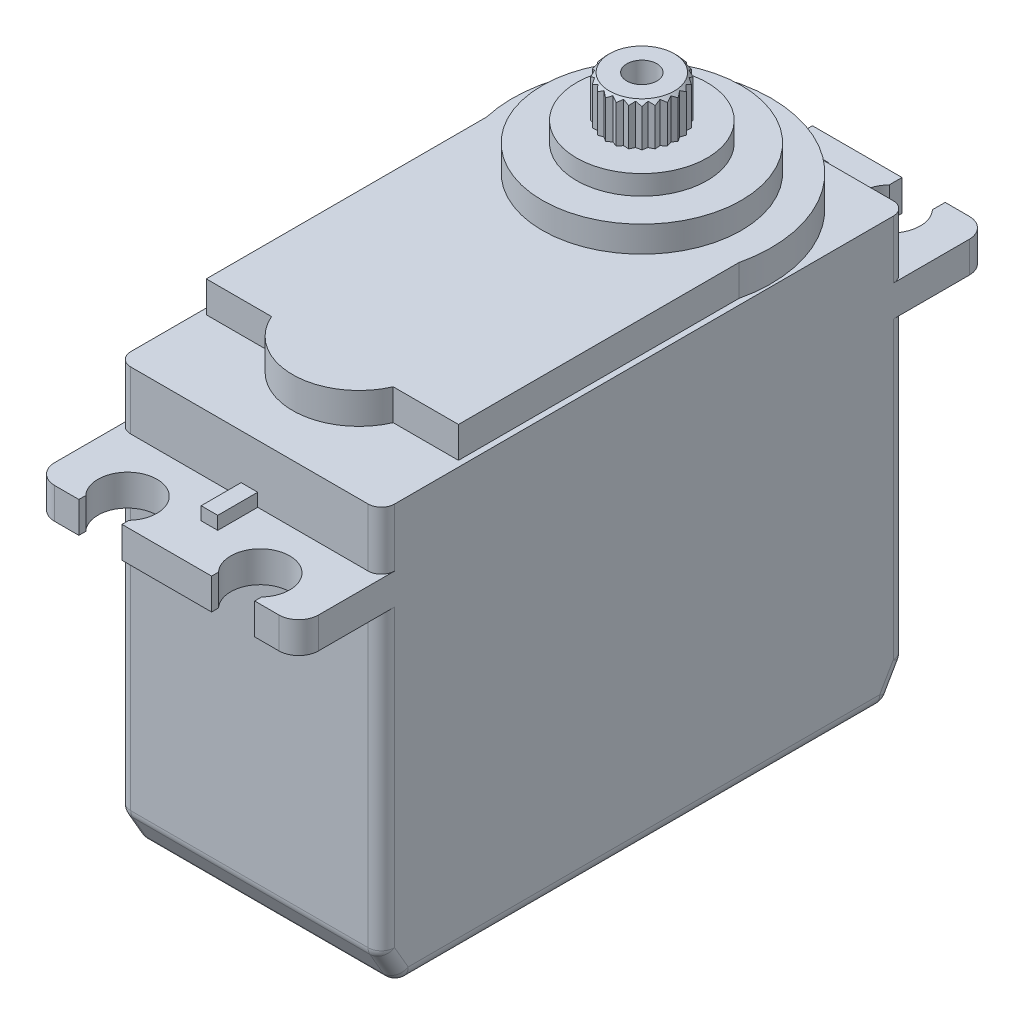
from build123d import *
from OCP.BRepFilletAPI import BRepFilletAPI_MakeChamfer

# Parameters (mm, degrees)
SKETCH1_W          = 20.2
SKETCH1_H          = 40.2
EXTRUDE1_DEPTH     = 25.4
SKETCH2_W          = 20.2
SKETCH2_H          = 40.2
EXTRUDE2_DEPTH     = 2.38125
SKETCH3_W          = 20.2
SKETCH3_H          = 40.2
EXTRUDE3_DEPTH     = 4.445
EXTRUDE4_DEPTH     = 2.38125
SKETCH5_R          = 7.62
EXTRUDE5_DEPTH     = 3.4925
SKETCH7_W          = 3.5
SKETCH7_H          = 1
EXTRUDE6_DEPTH     = 0.635
SKETCH8_R          = 2.778125
EXTRUDE7_DEPTH     = 3.175
CHAMFER2_SIZE      = 2.54
CHAMFER2_SIZE2     = 1.466469684
FILLET1_R          = 1.016
FILLET2_R          = 1.524
SKETCH9_W          = 6.35
SKETCH9_H          = 2.54
EXTRUDE8_DEPTH     = 2.38125
SKETCH10_W         = 5.08
SKETCH10_H         = 1.27
CUT_EXTRUDE1_DEPTH = 2.38125
CHAMFER3_SIZE      = 0.3
SKETCH11_R         = 3.778125
CUT_EXTRUDE2_DEPTH = 3.175
SKETCH12_R         = 1.15
CUT_EXTRUDE3_DEPTH = 3
CUT_EXTRUDE4_START = -1.5
SKETCH13_R         = 7.62
SKETCH13_R_2       = 5
CUT_EXTRUDE4_DEPTH = 1.5


with BuildPart() as part:
    # Sketch1 → Extrude1 (new body)
    with BuildSketch(Plane(origin=(0, 0, 0), x_dir=(1, 0, 0), z_dir=(0, 1, 0))):
        with Locations((0, -9.94)):
            Rectangle(SKETCH1_W, SKETCH1_H)
    extrude(amount=EXTRUDE1_DEPTH)

    # Sketch2 → Extrude2 (add)
    with BuildSketch(Plane(origin=(0, 25.4, 0), x_dir=(-1, 0, 0), z_dir=(0, 1, 0))):
        with Locations((0, 9.94)):
            Rectangle(SKETCH2_W, SKETCH2_H)
        with BuildLine():
            ThreePointArc((6.731, -15.51418631), (5.08, -11.7094), (3.429, -15.51418631))
            Line((3.429, -15.51418631), (3.429, -16.4846))
            Line((3.429, -16.4846), (-3.429, -16.4846))
            Line((-3.429, -16.4846), (-3.429, -15.51418631))
            ThreePointArc((-3.429, -15.51418631), (-5.08, -11.7094), (-6.731, -15.51418631))
            Line((-6.731, -15.51418631), (-6.731, -16.4846))
            Line((-6.731, -16.4846), (-10.1, -16.4846))
            Line((-10.1, -16.4846), (-10.1, -10.16))
            Line((-10.1, -10.16), (10.1, -10.16))
            Line((10.1, -10.16), (10.1, -16.4846))
            Line((10.1, -16.4846), (6.731, -16.4846))
            Line((6.731, -16.4846), (6.731, -15.51418631))
        make_face()
        with BuildLine():
            ThreePointArc((-6.731, 35.83418631), (-5.08, 32.0294), (-3.429, 35.83418631))
            Line((-3.429, 35.83418631), (-3.429, 36.3646))
            Line((-3.429, 36.3646), (3.429, 36.3646))
            Line((3.429, 36.3646), (3.429, 35.83418631))
            ThreePointArc((3.429, 35.83418631), (5.08, 32.0294), (6.731, 35.83418631))
            Line((6.731, 35.83418631), (6.731, 36.3646))
            Line((6.731, 36.3646), (10.1, 36.3646))
            Line((10.1, 36.3646), (10.1, 30.04))
            Line((10.1, 30.04), (-10.1, 30.04))
            Line((-10.1, 30.04), (-10.1, 36.3646))
            Line((-10.1, 36.3646), (-6.731, 36.3646))
            Line((-6.731, 36.3646), (-6.731, 35.83418631))
        make_face()
    extrude(amount=EXTRUDE2_DEPTH)

    # Sketch3 → Extrude3 (add)
    with BuildSketch(Plane(origin=(0, 27.78125, 0), x_dir=(-1, 0, 0), z_dir=(0, 1, 0))):
        with Locations((0, 9.94)):
            Rectangle(SKETCH3_W, SKETCH3_H)
    extrude(amount=EXTRUDE3_DEPTH)

    # Sketch4 → Extrude4 (add)
    with BuildSketch(Plane(origin=(0, 32.22625, 0), x_dir=(-1, 0, 0), z_dir=(0, 1, 0))):
        with BuildLine():
            Line((9.652, 2.228840954), (9.652, 23.69))
            Line((9.652, 23.69), (4.655896906, 23.69))
            ThreePointArc((4.655896906, 23.69), (0, 26.738), (-4.655896906, 23.69))
            Line((-4.655896906, 23.69), (-9.652, 23.69))
            Line((-9.652, 23.69), (-9.652, 2.228840954))
            ThreePointArc((-9.652, 2.228840954), (0, -9.906), (9.652, 2.228840954))
        make_face()
    extrude(amount=EXTRUDE4_DEPTH)

    # Sketch5 → Extrude5 (add)
    with BuildSketch(Plane(origin=(0, 34.6075, 0), x_dir=(-1, 0, 0), z_dir=(0, 1, 0))):
        with Locations(Location((0, 0, 0), (0, 0, 270))):
            Circle(SKETCH5_R)
    extrude(amount=EXTRUDE5_DEPTH)

    # Sketch7 → Extrude6 (add, symmetric)
    with BuildSketch(Plane(origin=(0, 0, 0), x_dir=(0, 0, -1), z_dir=(1, 0, 0))):
        with Locations((11.91, 28.28125)):
            Rectangle(SKETCH7_W, SKETCH7_H)
    extrude6 = extrude(amount=EXTRUDE6_DEPTH, both=True)

    # Mirror1: Extrude6 across plane
    add(extrude6.mirror(Plane.XY.offset(9.72)))

    # Sketch8 → Extrude7 (add)
    with BuildSketch(Plane(origin=(0, 38.1, 0), x_dir=(-1, 0, 0), z_dir=(0, 1, 0))):
        with Locations(Location((0, 0, 0), (0, 0, 270))):
            Circle(SKETCH8_R)
    extrude(amount=EXTRUDE7_DEPTH)

    # Chamfer2: one chamfer whose edges measure the first distance from different faces: ONE call of the kernel's chamfer builder (chamfer() names one face for all edges)
    chamfer2_edges_1 = [part.edges().sort_by_distance(p)[0] for p in [
        (0, 0, -10.16),
    ]]
    chamfer2_side_1 = [part.faces().sort_by_distance(p)[0] for p in [
        (0, 12.7, -10.16),
    ]]
    chamfer2_edges_2 = [part.edges().sort_by_distance(p)[0] for p in [
        (0, 0, 30.04),
    ]]
    chamfer2_side_2 = [part.faces().sort_by_distance(p)[0] for p in [
        (0, 12.7, 30.04),
    ]]
    chamfer2 = BRepFilletAPI_MakeChamfer(part.part.solid().wrapped)
    for e in chamfer2_edges_1:
        chamfer2.Add(CHAMFER2_SIZE, CHAMFER2_SIZE2, e.wrapped, chamfer2_side_1[0].wrapped)  # the first distance lies on this face
    for e in chamfer2_edges_2:
        chamfer2.Add(CHAMFER2_SIZE, CHAMFER2_SIZE2, e.wrapped, chamfer2_side_2[0].wrapped)  # the first distance lies on this face
    add(Compound.cast(chamfer2.Shape()), mode=Mode.REPLACE)

    # Fillet1
    fillet1_edges = [part.edges().sort_by_distance(p)[0] for p in [
        (-10.1, 30.00375, -10.16),
        (10.1, 30.00375, -10.16),
        (10.1, 30.00375, 30.04),
        (10.1, 0, 9.94),
        (10.1, 1.27, -9.426765158),
        (10.1, 13.97, -10.16),
        (0, 0, -8.693530316),
        (0, 2.54, -10.16),
        (-10.1, 13.97, -10.16),
        (-10.1, 1.27, -9.426765158),
        (10.1, 13.97, 30.04),
        (10.1, 1.27, 29.306765158),
        (0, 2.54, 30.04),
        (-10.1, 0, 9.94),
        (0, 0, 28.573530316),
        (-10.1, 1.27, 29.306765158),
        (-10.1, 13.97, 30.04),
        (-10.1, 30.00375, 30.04),
    ]]
    fillet(fillet1_edges, radius=FILLET1_R)

    # Fillet2
    fillet2_edges = [part.edges().sort_by_distance(p)[0] for p in [
        (-10.1, 26.590625, 36.3646),
        (10.1, 26.590625, 36.3646),
        (-10.1, 26.590625, -16.4846),
        (10.1, 26.590625, -16.4846),
    ]]
    fillet(fillet2_edges, radius=FILLET2_R)

    # Sketch9 → Extrude8 (add)
    with BuildSketch(Plane(origin=(0, 0, -10.16), x_dir=(-1, 0, 0), z_dir=(0, 0, -1))):
        with Locations((0, 4.318)):
            Rectangle(SKETCH9_W, SKETCH9_H)
    extrude(amount=EXTRUDE8_DEPTH)

    # Sketch10 → Cut-Extrude1 (cut)
    with BuildSketch(Plane(origin=(0, 0, -12.54125), x_dir=(-1, 0, 0), z_dir=(0, 0, -1))):
        with Locations((0, 4.318)):
            Rectangle(SKETCH10_W, SKETCH10_H)
    extrude(amount=-CUT_EXTRUDE1_DEPTH, mode=Mode.SUBTRACT)

    # Chamfer3
    chamfer3_edges = [part.edges().sort_by_distance(p)[0] for p in [
        (0, 41.275, 2.778125),
    ]]
    chamfer(chamfer3_edges, length=CHAMFER3_SIZE)

    # Sketch11 → Cut-Extrude2 (cut)
    with BuildSketch(Plane(origin=(0, 41.275, 0), x_dir=(1, 0, 0), z_dir=(0, 1, 0))):
        Circle(SKETCH11_R)
        Polygon((0, -2.778125), (-0.336512839, -2.556068783), (-0.71903166, -2.683462686), (-0.986605724, -2.38187692), (-1.3890625, -2.405926825), (-1.569463059, -2.04536408), (-1.964431026, -1.964431026), (-2.04536408, -1.569463059), (-2.405926825, -1.3890625), (-2.38187692, -0.986605724), (-2.683462686, -0.71903166), (-2.556068783, -0.336512839), (-2.778125, 0), (-2.556068783, 0.336512839), (-2.683462686, 0.71903166), (-2.38187692, 0.986605724), (-2.405926825, 1.3890625), (-2.04536408, 1.569463059), (-1.964431026, 1.964431026), (-1.569463059, 2.04536408), (-1.3890625, 2.405926825), (-0.986605724, 2.38187692), (-0.71903166, 2.683462686), (-0.336512839, 2.556068783), (0, 2.778125), (0.336512839, 2.556068783), (0.71903166, 2.683462686), (0.986605724, 2.38187692), (1.3890625, 2.405926825), (1.569463059, 2.04536408), (1.964431026, 1.964431026), (2.04536408, 1.569463059), (2.405926825, 1.3890625), (2.38187692, 0.986605724), (2.683462686, 0.71903166), (2.556068783, 0.336512839), (2.778125, 0), (2.556068783, -0.336512839), (2.683462686, -0.71903166), (2.38187692, -0.986605724), (2.405926825, -1.3890625), (2.04536408, -1.569463059), (1.964431026, -1.964431026), (1.569463059, -2.04536408), (1.3890625, -2.405926825), (0.986605724, -2.38187692), (0.71903166, -2.683462686), (0.336512839, -2.556068783), align=None, mode=Mode.SUBTRACT)
    extrude(amount=-CUT_EXTRUDE2_DEPTH, mode=Mode.SUBTRACT)

    # Sketch12 → Cut-Extrude3 (cut)
    with BuildSketch(Plane(origin=(0, 41.275, 0), x_dir=(1, 0, 0), z_dir=(0, 1, 0))):
        with Locations(Location((0, 0, 0), (0, 0, 270))):
            Circle(SKETCH12_R)
    extrude(amount=-CUT_EXTRUDE3_DEPTH, mode=Mode.SUBTRACT)

    # Sketch13 → Cut-Extrude4 (cut)
    with BuildSketch(Plane(origin=(0, 38.1, 0), x_dir=(1, 0, 0), z_dir=(0, 1, 0)).offset(CUT_EXTRUDE4_START)):
        with Locations(Location((0, 0, 0), (0, 0, 90))):
            Circle(SKETCH13_R)
        with Locations(Location((0, 0, 0), (0, 0, 270))):
            Circle(SKETCH13_R_2, mode=Mode.SUBTRACT)
    extrude(amount=CUT_EXTRUDE4_DEPTH, mode=Mode.SUBTRACT)


solid = part.part
